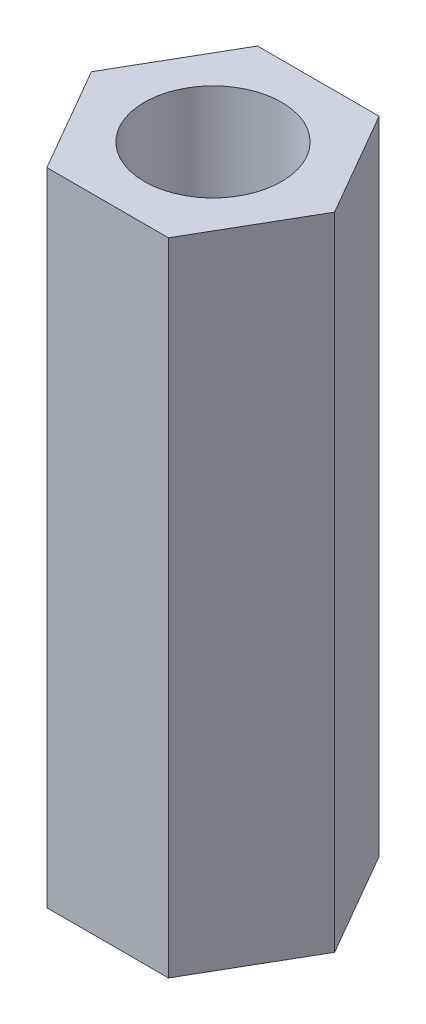
from build123d import *

# Parameters (mm, degrees)
EXTRUDE_1_DEPTH = 14
HOLE_WIZARD_1_D = 3


with BuildPart() as part:
    # 草图1 → 凸台-拉伸1 (new body)
    with BuildSketch(Plane(origin=(0, 0, 0), x_dir=(1, 0, 0), z_dir=(0, 1, 0))):
        Polygon((2.655811238, 0), (1.327905619, 2.3), (-1.327905619, 2.3), (-2.655811238, 0), (-1.327905619, -2.3), (1.327905619, -2.3), align=None)
    extrude(amount=EXTRUDE_1_DEPTH)

    # 孔1 (through all)
    with Locations(Plane(origin=(0, 14, 0), x_dir=(1, 0, 0), z_dir=(0, 1, 0))):
        with Locations((0, 0)):
            Hole(HOLE_WIZARD_1_D / 2)


solid = part.part
